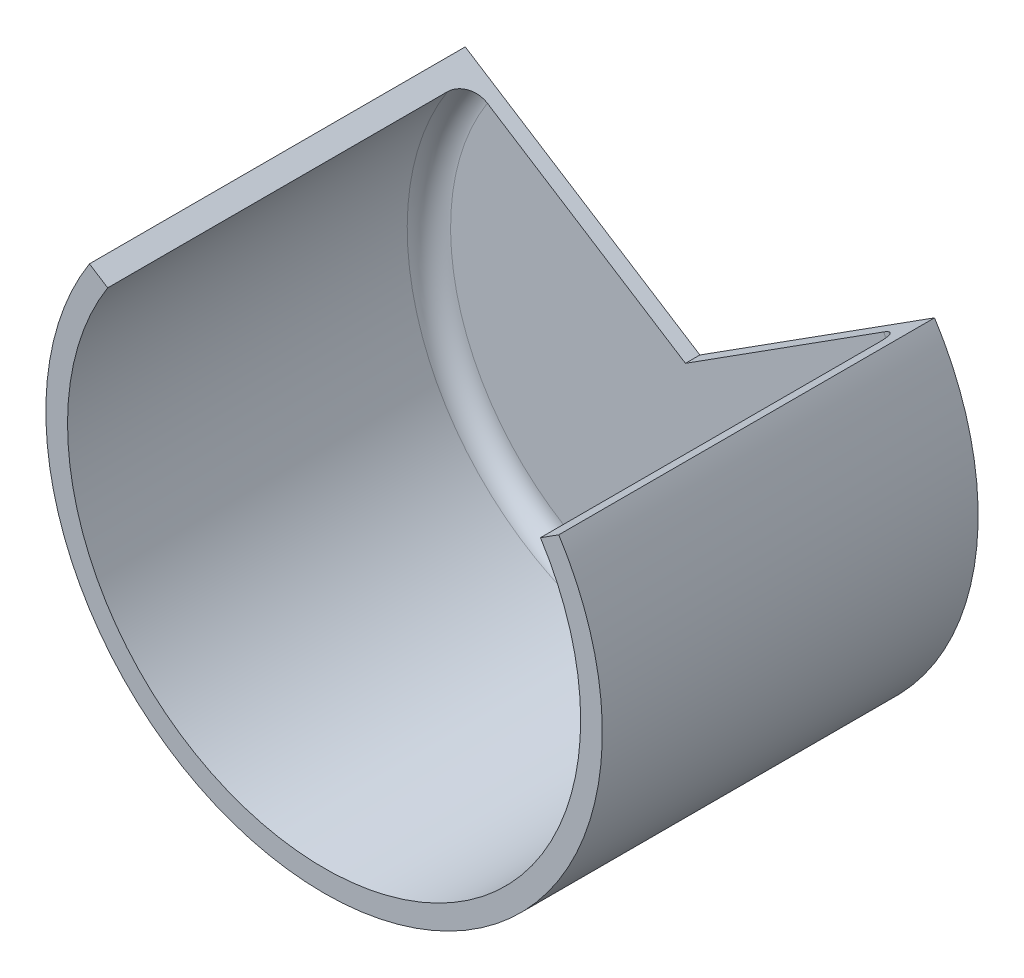
from build123d import *
from build123d.topology import SkipClean

# Parameters (mm, degrees)
SKETCH1_R           = 19.25
SKETCH1_R_2         = 17.75
BOSS_EXTRUDE1_DEPTH = 25
BOSS_EXTRUDE2_START = 1
SKETCH2_R           = 19.25
BOSS_EXTRUDE2_DEPTH = 1
CUT_EXTRUDE1_DEPTH  = 38.644720745
FILLET2_R           = 1.5


with BuildPart() as part:
    # Sketch1 → Boss-Extrude1 (new body)
    with BuildSketch(Plane.XY):
        Circle(SKETCH1_R)
        Circle(SKETCH1_R_2, mode=Mode.SUBTRACT)
    extrude(amount=BOSS_EXTRUDE1_DEPTH)

    # Sketch2 → Boss-Extrude2 (add)
    with BuildSketch(Plane(origin=(0, 0, 0), x_dir=(-1, 0, 0), z_dir=(0, 0, -1)).offset(BOSS_EXTRUDE2_START)):
        Circle(SKETCH2_R)
    extrude(amount=-BOSS_EXTRUDE2_DEPTH)

    # Sketch3 → Cut-Extrude1 (cut, through all)
    with SkipClean():  # the faces are left unmerged after this step: merging them gives an invalid solid
        with BuildSketch(Plane(origin=(0, 0, -1), x_dir=(-1, 0, 0), z_dir=(0, 0, -1))):
            with BuildLine():
                Line((-16.235285332, 10.343017461), (0, 0))
                Line((0, 0), (16.235285332, 10.343017461))
                ThreePointArc((16.235285332, 10.343017461), (0, 19.25), (-16.235285332, 10.343017461))
            make_face()
        extrude(amount=-CUT_EXTRUDE1_DEPTH, mode=Mode.SUBTRACT)

    # Fillet2
    fillet2_edges = [part.edges().sort_by_distance(p)[0] for p in [
        (-4.966964999, -17.040884915, 0),
    ]]
    fillet(fillet2_edges, radius=FILLET2_R)


solid = part.part
